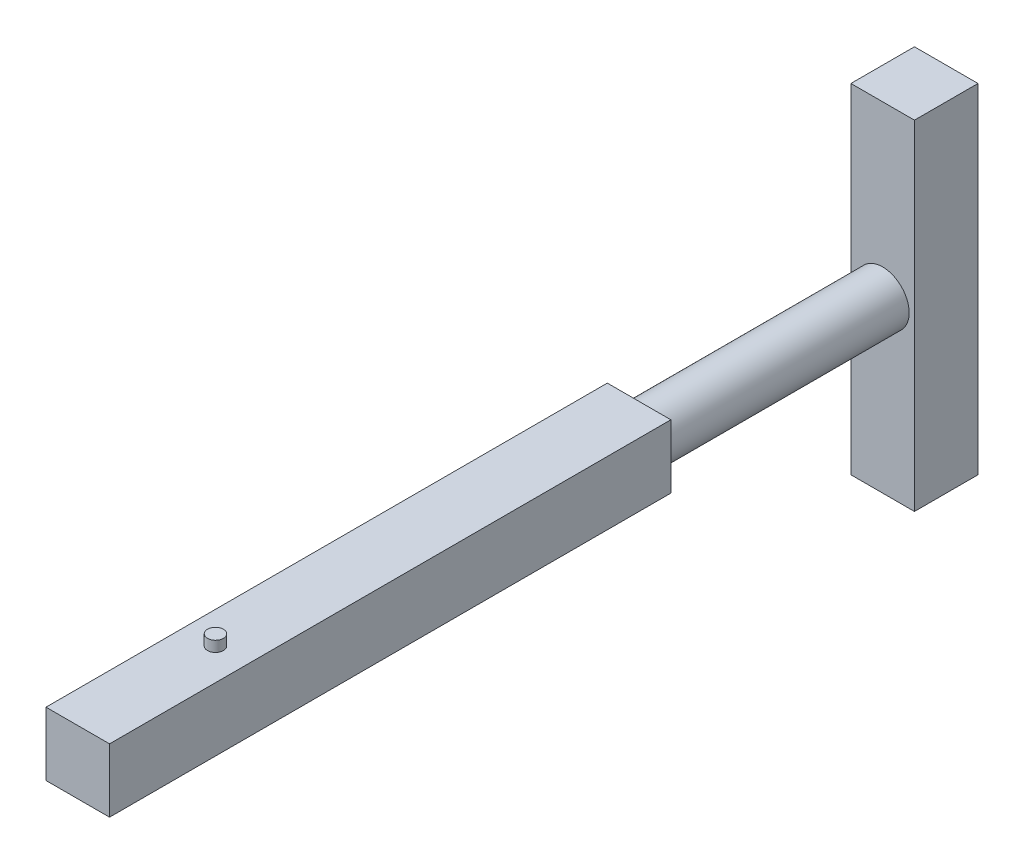
from build123d import *

# Parameters (mm, degrees)
SKETCH_1_W          = 60
SKETCH_1_H          = 60
EXTRUDE_1_DEPTH     = 530
SKETCH_2_R          = 25
EXTRUDE_2_DEPTH     = 230
SKETCH_3_R          = 7.5
EXTRUDE_3_DEPTH     = 10
EXTRUDE_START       = 10
SKETCH_4_R          = 7.5
EXTRUDE_4_DEPTH     = 10
SKETCH_5_W          = 60
SKETCH_5_H          = 320
EXTRUDE_5_DEPTH     = 60
SKETCH_6_R          = 7.5
CUT_EXTRUDE_1_DEPTH = 40


with BuildPart() as part:
    # 草图1 → 凸台-拉伸1 (new body)
    with BuildSketch(Plane.XY):
        Rectangle(SKETCH_1_W, SKETCH_1_H)
    extrude(amount=EXTRUDE_1_DEPTH)

    # 草图2 → 凸台-拉伸2 (add)
    with BuildSketch(Plane(origin=(0, 0, 0), x_dir=(-1, 0, 0), z_dir=(0, 0, -1))):
        Circle(SKETCH_2_R)
    extrude(amount=EXTRUDE_2_DEPTH)

    # 草图3 → 凸台-拉伸3 (add)
    with BuildSketch(Plane(origin=(0, 30, 0), x_dir=(1, 0, 0), z_dir=(0, 1, 0))):
        with Locations(Location((0, -400, 0), (0, 0, 90))):
            Circle(SKETCH_3_R)
    extrude(amount=EXTRUDE_3_DEPTH)

    # 草图4 → 凸台-拉伸4 (add)
    with BuildSketch(Plane.XZ.offset(30).offset(EXTRUDE_START)):
        with Locations(Location((0, 400, 0), (0, 0, 270))):
            Circle(SKETCH_4_R)
    extrude(amount=-EXTRUDE_4_DEPTH)

    # 草图5 → 凸台-拉伸5 (add)
    with BuildSketch(Plane(origin=(0, 0, -230), x_dir=(-1, 0, 0), z_dir=(0, 0, -1))):
        Rectangle(SKETCH_5_W, SKETCH_5_H)
    extrude(amount=EXTRUDE_5_DEPTH)

    # 草图6 → 切除-拉伸1 (cut)
    with BuildSketch(Plane(origin=(0, 0, -290), x_dir=(-1, 0, 0), z_dir=(0, 0, -1))):
        Circle(SKETCH_6_R)
    extrude(amount=-CUT_EXTRUDE_1_DEPTH, mode=Mode.SUBTRACT)


solid = part.part
